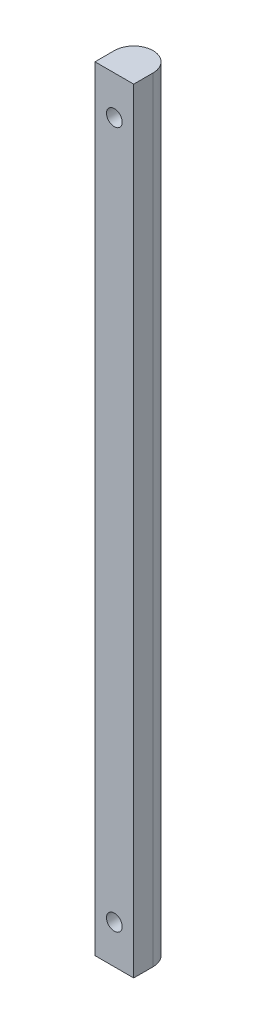
from build123d import *

# Parameters (mm, degrees)
BOSS_EXTRUDE1_DEPTH   = 63.5
F_5_40_TAPPED_HOLE1_D = 2.5781


with BuildPart() as part:
    # Sketch1 → Boss-Extrude1 (new, symmetric)
    with BuildSketch(Plane(origin=(0, 0, 0), x_dir=(1, 0, 0), z_dir=(0, 1, 0))):
        with BuildLine():
            Line((-3.175, 3.175), (-3.175, 0))
            Line((-3.175, 0), (3.175, 0))
            Line((3.175, 0), (3.175, 3.175))
            ThreePointArc((3.175, 3.175), (0, 6.35), (-3.175, 3.175))
        make_face()
    extrude(amount=BOSS_EXTRUDE1_DEPTH, both=True)

    # #5-40 Tapped Hole1 (through all)
    with Locations(Plane.XY):
        with Locations((0, -57.15)):
            f_5_40_tapped_hole1 = Hole(F_5_40_TAPPED_HOLE1_D / 2)

    # Mirror1: #5-40 Tapped Hole1 across plane
    add(f_5_40_tapped_hole1.mirror(Plane.ZX), mode=Mode.SUBTRACT)


solid = part.part
